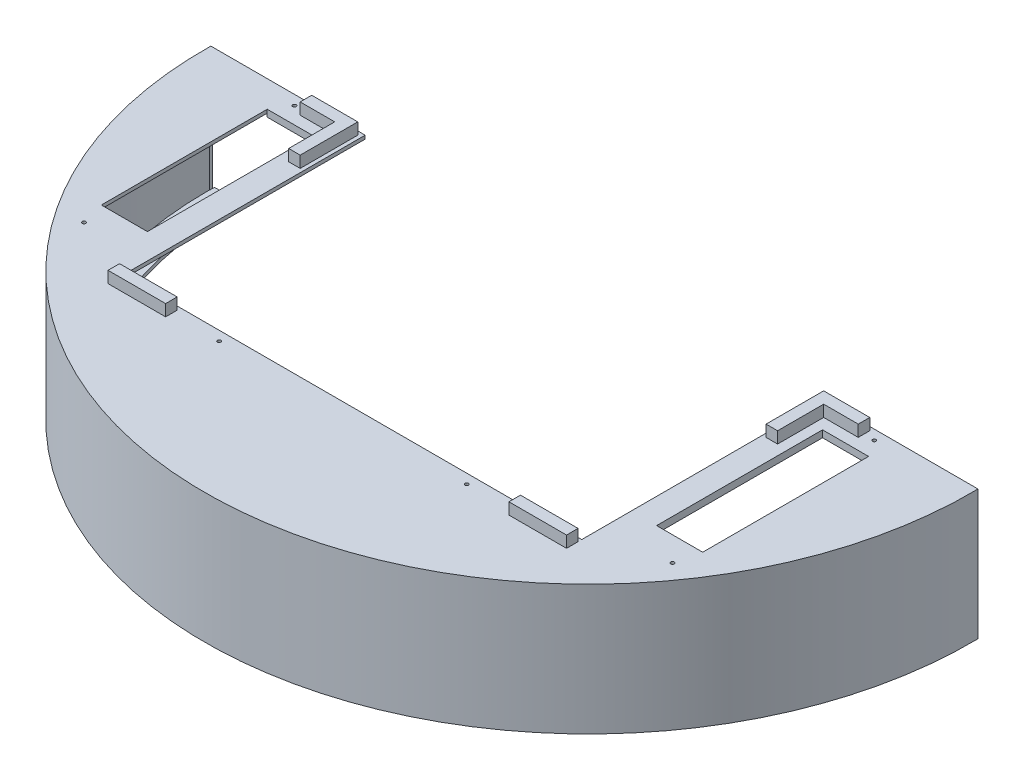
from build123d import *

# Parameters (mm, degrees)
BOSS_EXTRUDE2_DEPTH      = 3
BOSS_EXTRUDE2_DEPTH_BACK = 109.6
SKETCH3_R                = 333
SKETCH3_R_2              = 330
SKETCH5_R                = 330
BOSS_EXTRUDE4_DEPTH      = 3
SKETCH6_R                = 333
BOSS_EXTRUDE6_DEPTH      = 3
SKETCH17_R               = 330
BOSS_EXTRUDE9_DEPTH      = 3
CUT_EXTRUDE1_DEPTH       = 501.508020593
CUT_EXTRUDE1_DEPTH_BACK  = 501.508020593
SKETCH18_W               = 712.715925151
SKETCH18_H               = 346.222463294
SKETCH19_W               = 50
SKETCH19_H               = 10
SKETCH19_W_2             = 10
SKETCH19_H_2             = 50
SKETCH19_W_3             = 30
BOSS_EXTRUDE10_DEPTH     = 10
SKETCH20_W               = 1.85878785
SKETCH20_H               = 109.6
SKETCH20_W_2             = 1.900186503
CUT_EXTRUDE2_DEPTH       = 4.1
CUT_EXTRUDE3_START       = -11
SKETCH23_R               = 1.5
CUT_EXTRUDE3_DEPTH       = 11
SKETCH24_W               = 40
SKETCH24_H               = 144
CUT_EXTRUDE4_DEPTH       = 3
BOSS_EXTRUDE11_DEPTH     = 3


with BuildPart() as part:
    # Sketch3 → Boss-Extrude2 (new, two sides: drawn at the far end of the back side and taken through both)
    with BuildSketch(Plane(origin=(0, 0, 0), x_dir=(1, 0, 0), z_dir=(0, 1, 0)).offset(-BOSS_EXTRUDE2_DEPTH_BACK)):
        with Locations(Location((-11.008302555, 15.174390861, 0), (0, 0, 270))):
            Circle(SKETCH3_R)
        with Locations(Location((-11.008302555, 15.174390861, 0), (0, 0, 270))):
            Circle(SKETCH3_R_2, mode=Mode.SUBTRACT)
    extrude(amount=BOSS_EXTRUDE2_DEPTH + BOSS_EXTRUDE2_DEPTH_BACK)

    # Sketch5 → Boss-Extrude4 (add)
    with BuildSketch(Plane.XZ.offset(104.6)):
        with Locations(Location((-11.008302555, -15.174390861, 0), (0, 0, 90))):
            Circle(SKETCH5_R)
        with BuildLine():
            Line((-164.332788108, -283.060090014), (142.316182998, -283.060090014))
            ThreePointArc((142.316182998, -283.060090014), (-11.008302555, 293.485852256), (-164.332788108, -283.060090014))
        make_face(mode=Mode.SUBTRACT)
    extrude(amount=-BOSS_EXTRUDE4_DEPTH)

    # Sketch6 → Boss-Extrude6 (add)
    with BuildSketch(Plane(origin=(0, 0, 0), x_dir=(1, 0, 0), z_dir=(0, 1, 0))):
        with Locations(Location((-11.008302555, 15.174390861, 0), (0, 0, 270))):
            Circle(SKETCH6_R)
        Polygon((187.991697445, -189.598621739), (187.991697445, 20.401378261), (224.991697445, 20.401378261), (224.991697445, 100.970480915), (60.317326344, 288.174390861), (-82.333931455, 288.174390861), (-247.008302555, 100.970480915), (-247.008302555, 20.401378261), (-210.008302555, 20.401378261), (-210.008302555, -189.598621739), align=None, mode=Mode.SUBTRACT)
    extrude(amount=BOSS_EXTRUDE6_DEPTH)

    # Sketch17 → Boss-Extrude9 (add)
    with BuildSketch(Plane(origin=(0, -5, 0), x_dir=(1, 0, 0), z_dir=(0, 1, 0))):
        with Locations(Location((-11.008302555, 15.174390861, 0), (0, 0, 270))):
            Circle(SKETCH17_R)
        with BuildLine():
            Line((142.316182998, 283.060090014), (-164.332788108, 283.060090014))
            ThreePointArc((-164.332788108, 283.060090014), (-11.008302555, -293.485852256), (142.316182998, 283.060090014))
        make_face(mode=Mode.SUBTRACT)
    extrude(amount=-BOSS_EXTRUDE9_DEPTH)

    # Sketch18 → Cut-Extrude1 (cut, two sides: drawn at the far end of the back side and taken through both)
    with BuildSketch(Plane(origin=(0, -5, 0), x_dir=(1, 0, 0), z_dir=(0, 1, 0)).offset(-CUT_EXTRUDE1_DEPTH_BACK)):
        with Locations((-7.081493051, 193.512609908)):
            Rectangle(SKETCH18_W, SKETCH18_H)
    extrude(amount=CUT_EXTRUDE1_DEPTH + CUT_EXTRUDE1_DEPTH_BACK, mode=Mode.SUBTRACT)

    # Sketch19 → Boss-Extrude10 (add)
    with BuildSketch(Plane(origin=(0, 3, 0), x_dir=(1, 0, 0), z_dir=(0, 1, 0))):
        with Locations((-185.008302555, -197.798621739)):
            Rectangle(SKETCH19_W, SKETCH19_H)
        with Locations((162.991697445, -197.798621739)):
            Rectangle(SKETCH19_W, SKETCH19_H)
        with Locations((196.191697445, -7.798621739)):
            Rectangle(SKETCH19_W_2, SKETCH19_H_2)
        with Locations((216.191697445, 12.201378261)):
            Rectangle(SKETCH19_W_3, SKETCH19_H)
        with Locations((-238.208302555, 12.201378261)):
            Rectangle(SKETCH19_W_3, SKETCH19_H)
        with Locations((-218.208302555, -7.798621739)):
            Rectangle(SKETCH19_W_2, SKETCH19_H_2)
    extrude(amount=BOSS_EXTRUDE10_DEPTH)

    # Sketch20 → Cut-Extrude2 (cut)
    with BuildSketch(Plane(origin=(0, 0, -20.401378261), x_dir=(-1, 0, 0), z_dir=(0, 0, -1))):
        with Locations((-319.72109137, -54.8)):
            Rectangle(SKETCH20_W, SKETCH20_H)
        with Locations((341.716997154, -54.8)):
            Rectangle(SKETCH20_W_2, SKETCH20_H)
    extrude(amount=-CUT_EXTRUDE2_DEPTH, mode=Mode.SUBTRACT)

    # Sketch23 → Cut-Extrude3 (cut)
    with BuildSketch(Plane(origin=(0, 3, 0), x_dir=(1, 0, 0), z_dir=(0, 1, 0)).offset(CUT_EXTRUDE3_START)):
        with Locations(Location((-266.430595358, -167.218017294, 0), (0, 0, 270))):
            Circle(SKETCH23_R)
        with Locations(Location((-262.835878396, 11.878802847, 0), (0, 0, 270))):
            Circle(SKETCH23_R)
        with Locations(Location((240.383738856, 11.878802847, 0), (0, 0, 270))):
            Circle(SKETCH23_R)
        with Locations(Location((244.931055017, -167.7800562, 0), (0, 0, 270))):
            Circle(SKETCH23_R)
        with Locations(Location((-118.508302555, -197.879856977, 0), (0, 0, 270))):
            Circle(SKETCH23_R)
        with Locations(Location((96.491697445, -197.879856977, 0), (0, 0, 270))):
            Circle(SKETCH23_R)
    extrude(amount=CUT_EXTRUDE3_DEPTH, mode=Mode.SUBTRACT)

    # Sketch24 → Cut-Extrude4 (cut)
    with BuildSketch(Plane(origin=(0, 3, 0), x_dir=(1, 0, 0), z_dir=(0, 1, 0))):
        with Locations((-252.008302555, -74.598621739)):
            Rectangle(SKETCH24_W, SKETCH24_H)
        with Locations((229.991697445, -74.598621739)):
            Rectangle(SKETCH24_W, SKETCH24_H)
    extrude(amount=-CUT_EXTRUDE4_DEPTH, mode=Mode.SUBTRACT)

    # Sketch25 → Boss-Extrude11 (add)
    with BuildSketch(Plane.XZ):
        Polygon((-272.008302555, 149.598621739), (-272.008302555, 146.598621739), (-232.008302555, 146.598621739), (-232.008302555, 2.598621739), (-272.008302555, 2.598621739), (-272.008302555, -0.401378261), (-230.008302555, -0.401378261), (-230.008302555, 149.598621739), align=None)
        Polygon((249.991697445, 149.598621739), (207.991697445, 149.598621739), (207.991697445, -0.401378261), (249.991697445, -0.401378261), (249.991697445, 2.598621739), (209.991697445, 2.598621739), (209.991697445, 146.598621739), (249.991697445, 146.598621739), align=None)
    extrude(amount=BOSS_EXTRUDE11_DEPTH)


solid = part.part
